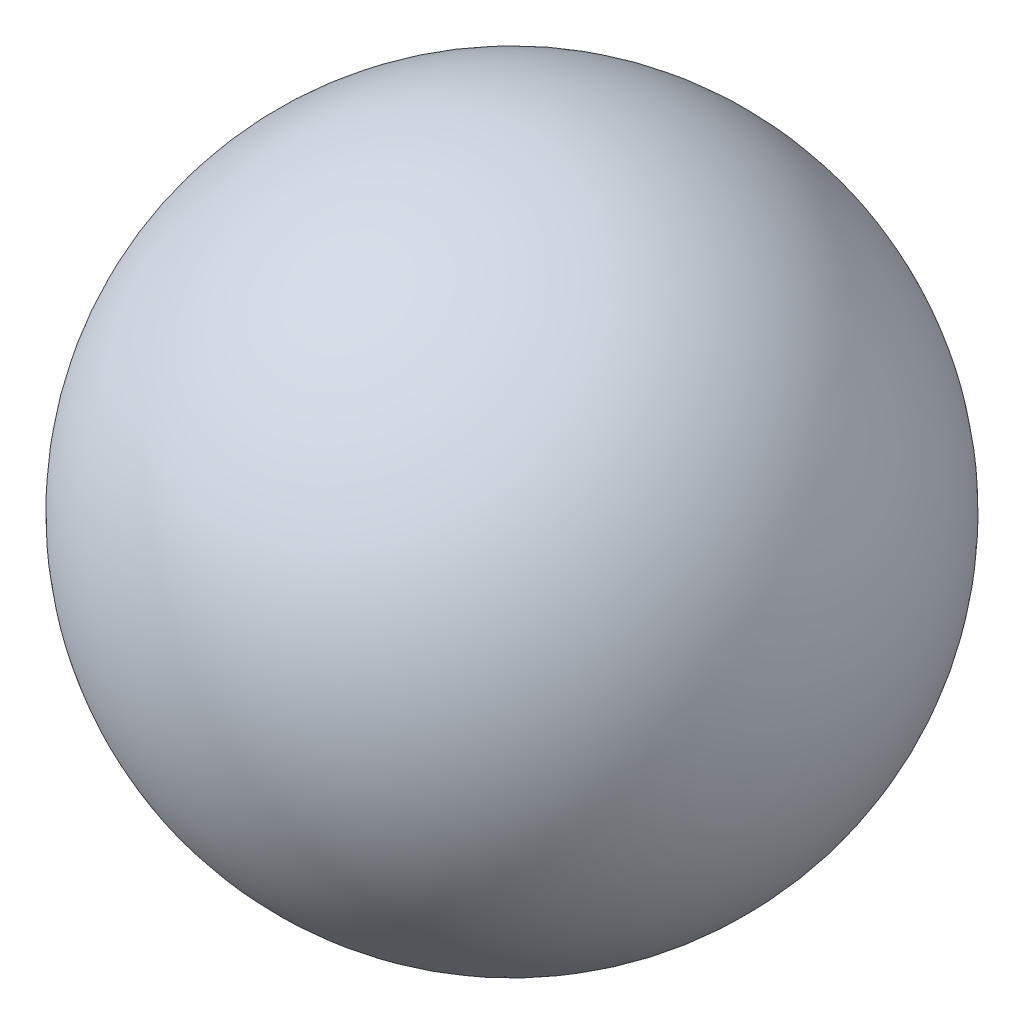
from build123d import *


with BuildPart() as part:
    # Sketch1 → Revolve1 (revolve)
    with BuildSketch(Plane(origin=(0, 0, 0), x_dir=(1, 0, 0), z_dir=(0, 1, 0))):
        with BuildLine():
            Line((0, 88.9), (0, -88.9))
            ThreePointArc((0, -88.9), (-88.9, 0), (0, 88.9))
        make_face()
    revolve(axis=Axis((0, 0, -88.9), (0, 0, 1)))


solid = part.part
